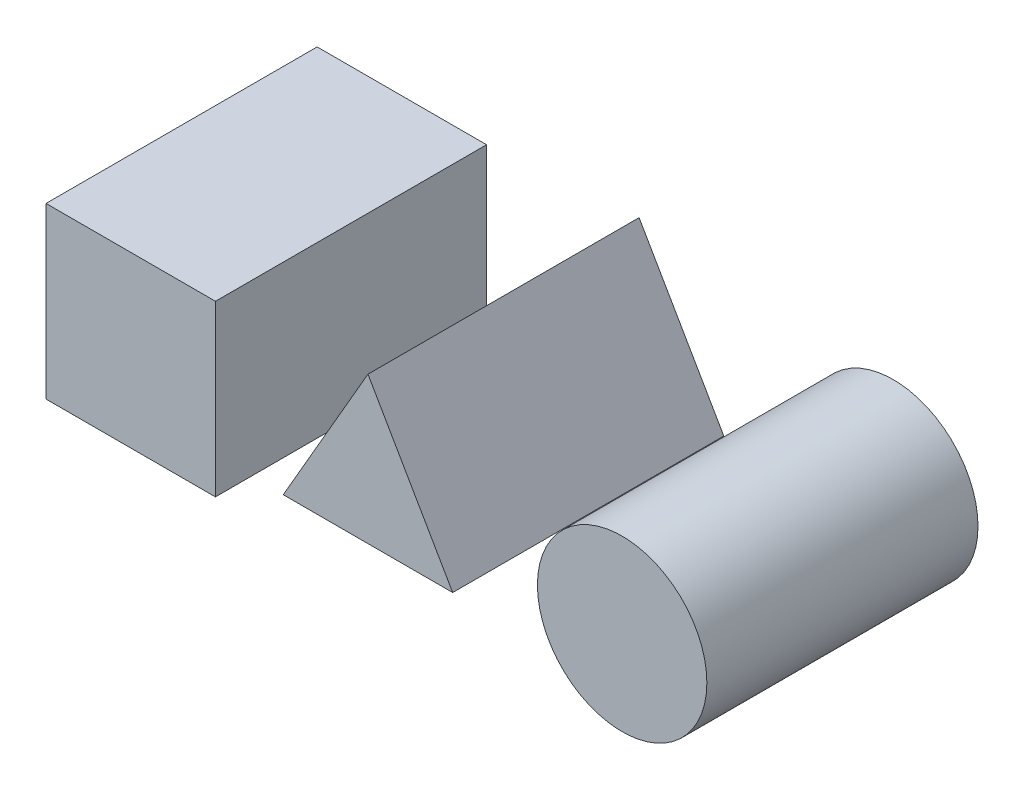
from build123d import *

# Parameters (mm, degrees)
SKETCH1_R             = 25
BOSS_EXTRUDE1_DEPTH   = 80
BOSS_EXTRUDE1_2_DEPTH = 80
SKETCH1_W             = 50
SKETCH1_H             = 50
BOSS_EXTRUDE1_3_DEPTH = 80


with BuildPart() as part:
    # Sketch1 → Boss-Extrude1 (new body)
    with BuildSketch(Plane.XY):
        with Locations((75, 0)):
            Circle(SKETCH1_R)
    extrude(amount=BOSS_EXTRUDE1_DEPTH)


with BuildPart() as body_2:
    # Sketch1 → Boss-Extrude1 2 (new body)
    with BuildSketch(Plane.XY):
        Polygon((-25, -14.43375673), (0, 28.867513459), (25, -14.43375673), align=None)
    extrude(amount=BOSS_EXTRUDE1_2_DEPTH)


with BuildPart() as body_3:
    # Sketch1 → Boss-Extrude1 3 (new body)
    with BuildSketch(Plane.XY):
        with Locations((-70, 0)):
            Rectangle(SKETCH1_W, SKETCH1_H)
    extrude(amount=BOSS_EXTRUDE1_3_DEPTH)


solid = Compound([part.part, body_2.part, body_3.part])
